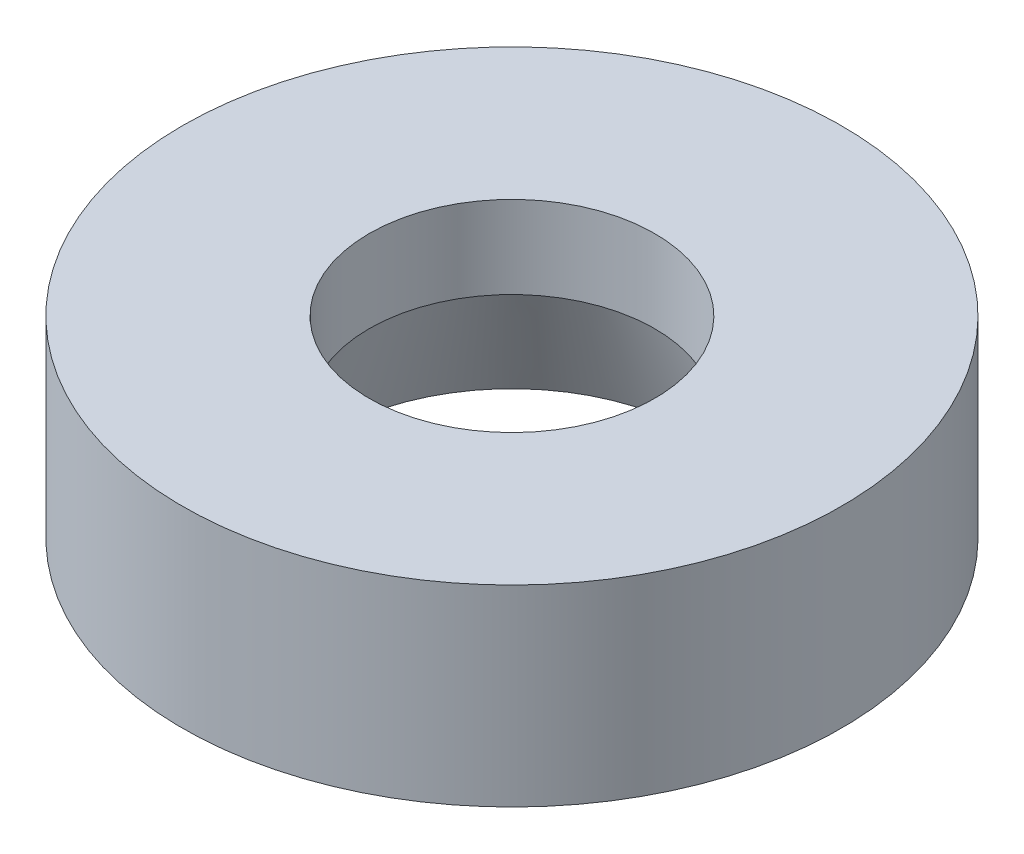
from build123d import *


with BuildPart() as part:
    # Szkic1 → Obrót1 (revolve)
    with BuildSketch(Plane.XY):
        Polygon((-60, 20.450998336), (-60, -14.549001664), (-33.279404685, -14.549001664), (-26, 5.450998336), (-26, 20.450998336), align=None)
    revolve(axis=Axis((0, 20.450998336, 0), (0, -1, 0)))


solid = part.part
